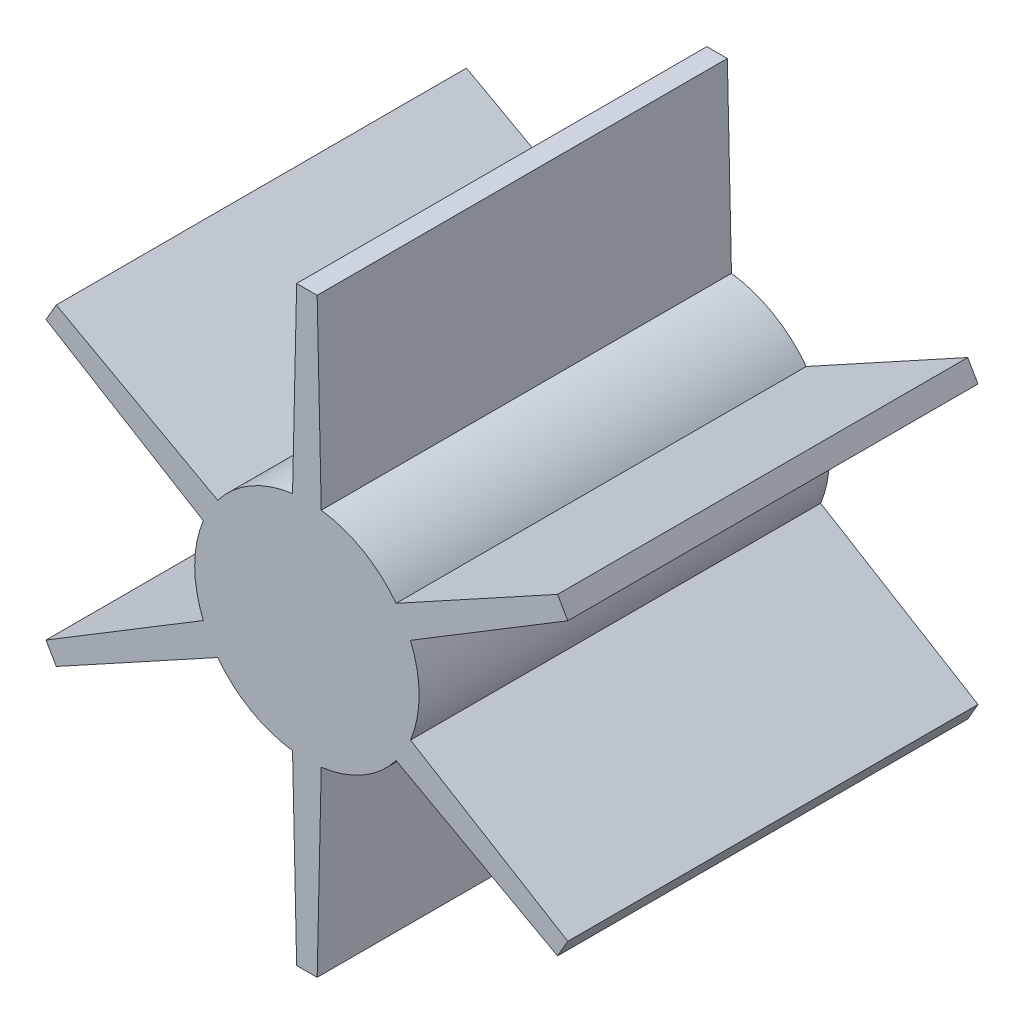
from build123d import *

# Parameters (mm, degrees)
BOSS_EXTRUDE1_DEPTH = 100


with BuildPart() as part:
    # Sketch1 → Boss-Extrude1 (new body)
    with BuildSketch(Plane.XY):
        with BuildLine():
            Line((3.5, 27.12898754), (2.5, 72))
            Line((2.5, 72), (-2.5, 72))
            Line((-2.5, 72), (-3.5, 27.12898754))
            ThreePointArc((-3.5, 27.12898754), (-13.676914536, 23.689110868), (-21.744392388, 16.595582683))
            Line((-21.744392388, 16.595582683), (-61.103829072, 38.165063509))
            Line((-61.103829072, 38.165063509), (-63.603829072, 33.834936491))
            Line((-63.603829072, 33.834936491), (-25.244392388, 10.533404857))
            ThreePointArc((-25.244392388, 10.533404857), (-27.353829072, 0), (-25.244392388, -10.533404857))
            Line((-25.244392388, -10.533404857), (-63.603829072, -33.834936491))
            Line((-63.603829072, -33.834936491), (-61.103829072, -38.165063509))
            Line((-61.103829072, -38.165063509), (-21.744392388, -16.595582683))
            ThreePointArc((-21.744392388, -16.595582683), (-13.676914536, -23.689110868), (-3.5, -27.12898754))
            Line((-3.5, -27.12898754), (-2.5, -72))
            Line((-2.5, -72), (2.5, -72))
            Line((2.5, -72), (3.5, -27.12898754))
            ThreePointArc((3.5, -27.12898754), (13.676914536, -23.689110868), (21.744392388, -16.595582683))
            Line((21.744392388, -16.595582683), (61.103829072, -38.165063509))
            Line((61.103829072, -38.165063509), (63.603829072, -33.834936491))
            Line((63.603829072, -33.834936491), (25.244392388, -10.533404857))
            ThreePointArc((25.244392388, -10.533404857), (27.353829072, 0), (25.244392388, 10.533404857))
            Line((25.244392388, 10.533404857), (63.603829072, 33.834936491))
            Line((63.603829072, 33.834936491), (61.103829072, 38.165063509))
            Line((61.103829072, 38.165063509), (21.744392388, 16.595582683))
            ThreePointArc((21.744392388, 16.595582683), (13.676914536, 23.689110868), (3.5, 27.12898754))
        make_face()
    extrude(amount=BOSS_EXTRUDE1_DEPTH)


solid = part.part
